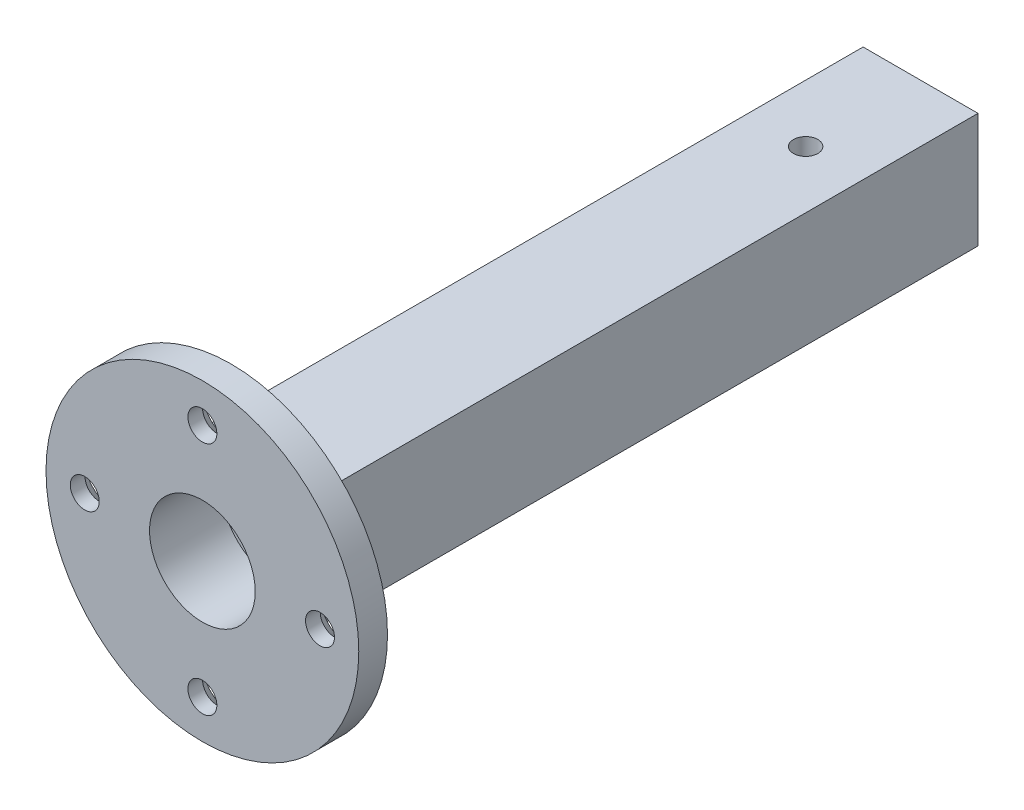
from build123d import *

# Parameters (mm, degrees)
SKETCH1_W                                       = 12.7
SKETCH1_H                                       = 12.7
BOSS_EXTRUDE1_DEPTH                             = 76.2
SKETCH4_R                                       = 4.064
CUT_EXTRUDE2_DEPTH                              = 25.4
SKETCH10_R                                      = 5.715
CUT_EXTRUDE3_DEPTH                              = 2.54
SKETCH11_R                                      = 17.2847
BOSS_EXTRUDE2_DEPTH                             = 3.175
CSK_FOR_M3_FLAT_HEAD_MACHINE_SCREW1_D           = 3.2
CSK_FOR_M3_FLAT_HEAD_MACHINE_SCREW1_CSINK_D     = 6.3
CSK_FOR_M3_FLAT_HEAD_MACHINE_SCREW1_CSINK_ANGLE = 90
FILLET1_R                                       = 1.27
SKETCH16_R                                      = 5.842
CUT_EXTRUDE4_DEPTH                              = 8
SKETCH17_R                                      = 1.3462
CUT_EXTRUDE5_DEPTH                              = 8


with BuildPart() as part:
    # Sketch1 → Boss-Extrude1 (new body)
    with BuildSketch(Plane.XY):
        with Locations((6.35, 6.35)):
            Rectangle(SKETCH1_W, SKETCH1_H)
    extrude(amount=BOSS_EXTRUDE1_DEPTH)

    # Sketch4 → Cut-Extrude2 (cut)
    with BuildSketch(Plane(origin=(0, 0, 0), x_dir=(-1, 0, 0), z_dir=(0, 0, -1))):
        with Locations((-6.35, 6.35)):
            Circle(SKETCH4_R)
    extrude(amount=-CUT_EXTRUDE2_DEPTH, mode=Mode.SUBTRACT)

    # Sketch10 → Cut-Extrude3 (cut)
    with BuildSketch(Plane(origin=(0, 0, 0), x_dir=(-1, 0, 0), z_dir=(0, 0, -1))):
        with Locations((-6.35, 6.35)):
            Circle(SKETCH10_R)
    extrude(amount=-CUT_EXTRUDE3_DEPTH, mode=Mode.SUBTRACT)

    # Sketch11 → Boss-Extrude2 (add)
    with BuildSketch(Plane.XY.offset(76.2)):
        with Locations((6.35, 6.35)):
            Circle(SKETCH11_R)
    extrude(amount=BOSS_EXTRUDE2_DEPTH)

    # CSK for M3 Flat Head Machine Screw1 (through all)
    with Locations(Plane(origin=(0, 0, 76.2), x_dir=(-1, 0, 0), z_dir=(0, 0, -1))):
        with Locations((-6.35, 19.35), (6.65, 6.35), (-6.35, -6.65), (-19.35, 6.35)):
            CounterSinkHole(CSK_FOR_M3_FLAT_HEAD_MACHINE_SCREW1_D / 2, CSK_FOR_M3_FLAT_HEAD_MACHINE_SCREW1_CSINK_D / 2, counter_sink_angle=CSK_FOR_M3_FLAT_HEAD_MACHINE_SCREW1_CSINK_ANGLE)

    # Fillet1
    fillet1_edges = [part.edges().sort_by_distance(p)[0] for p in [
        (12.7, 6.35, 76.2),
        (6.35, 12.7, 76.2),
        (0, 6.35, 76.2),
        (6.35, 0, 76.2),
    ]]
    fillet(fillet1_edges, radius=FILLET1_R)

    # Sketch16 → Cut-Extrude4 (cut)
    with BuildSketch(Plane.XY.offset(79.375)):
        with Locations((6.35, 6.35)):
            Circle(SKETCH16_R)
    extrude(amount=-CUT_EXTRUDE4_DEPTH, mode=Mode.SUBTRACT)

    # Sketch17 → Cut-Extrude5 (cut)
    with BuildSketch(Plane(origin=(0, 12.7, 0), x_dir=(1, 0, 0), z_dir=(0, 1, 0))):
        with Locations(Location((6.35, -12.7, 0), (0, 0, 270))):
            Circle(SKETCH17_R)
    extrude(amount=-CUT_EXTRUDE5_DEPTH, mode=Mode.SUBTRACT)


solid = part.part
